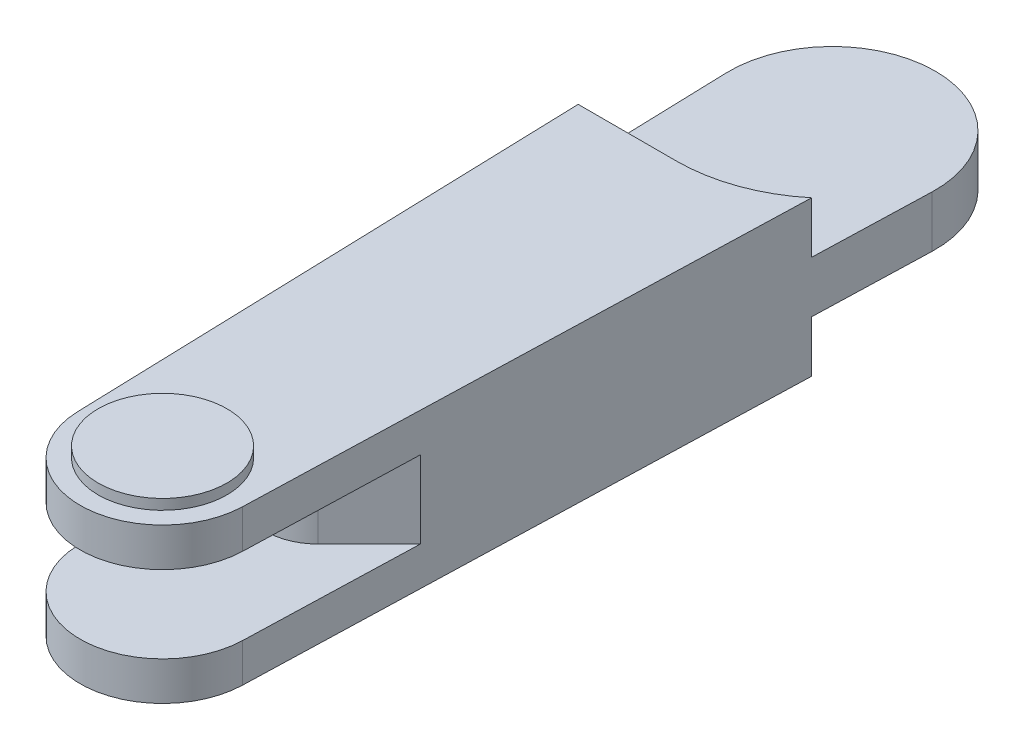
from build123d import *

# Parameters (mm, degrees)
BOSS_EXTRUDE1_DEPTH      = 1.5
BOSS_EXTRUDE1_DEPTH_BACK = 1.5
SKETCH1_R                = 1.6
SKETCH1_R_2              = 2
SKETCH2_R                = 3.025
CUT_EXTRUDE1_DEPTH       = 1
CUT_EXTRUDE2_START       = -1
SKETCH3_R                = 3.025
CUT_EXTRUDE2_DEPTH       = 1
CUT_EXTRUDE3_DEPTH       = 0.75
CUT_EXTRUDE3_DEPTH_BACK  = 0.75
SKETCH4_R                = 1.6
FILLET1_R                = 1
SKETCH5_R                = 1.25
BOSS_EXTRUDE2_DEPTH      = 0.2
BOSS_EXTRUDE3_START      = 0.2
SKETCH6_R                = 1.25
BOSS_EXTRUDE3_DEPTH      = 0.2
CUT_EXTRUDE4_DEPTH       = 1
CUT_EXTRUDE5_START       = -1
CUT_EXTRUDE5_DEPTH       = 1


with BuildPart() as part:
    # Sketch1 → Boss-Extrude1 (new, two sides: drawn at the far end of the back side and taken through both)
    with BuildSketch(Plane(origin=(0, 0, 0), x_dir=(1, 0, 0), z_dir=(0, 1, 0)).offset(-BOSS_EXTRUDE1_DEPTH_BACK)):
        with Locations((0, -6.5)):
            Circle(SKETCH1_R)
        with BuildLine():
            Line((-1.99905303, 6.438461538), (-1.599242424, -6.549230769))
            ThreePointArc((-1.599242424, -6.549230769), (-0.024618299, -4.900189405), (1.6, -6.5))
            ThreePointArc((1.6, -6.5), (1.599810595, -6.524618299), (1.599242424, -6.549230769))
            Line((1.599242424, -6.549230769), (1.99905303, 6.438461538))
            ThreePointArc((1.99905303, 6.438461538), (0, 4.5), (-1.99905303, 6.438461538))
        make_face()
        with Locations((0, 6.5)):
            Circle(SKETCH1_R_2)
    extrude(amount=BOSS_EXTRUDE1_DEPTH + BOSS_EXTRUDE1_DEPTH_BACK)

    # Sketch2 → Cut-Extrude1 (cut)
    with BuildSketch(Plane(origin=(0, 1.5, 0), x_dir=(1, 0, 0), z_dir=(0, 1, 0))):
        with Locations((0, 6.5)):
            Circle(SKETCH2_R)
    extrude(amount=-CUT_EXTRUDE1_DEPTH, mode=Mode.SUBTRACT)

    # Sketch3 → Cut-Extrude2 (cut)
    with BuildSketch(Plane.XZ.offset(1.5).offset(CUT_EXTRUDE2_START)):
        with Locations((0, -6.5)):
            Circle(SKETCH3_R)
    extrude(amount=CUT_EXTRUDE2_DEPTH, mode=Mode.SUBTRACT)

    # Sketch4 → Cut-Extrude3 (cut, two sides: drawn at the far end of the back side and taken through both)
    with BuildSketch(Plane(origin=(0, 0, 0), x_dir=(1, 0, 0), z_dir=(0, 1, 0)).offset(-CUT_EXTRUDE3_DEPTH_BACK)):
        with BuildLine():
            ThreePointArc((-1.6, -6.5), (-1.13137085, -5.36862915), (0, -4.9))
            Line((0, -4.9), (-163.946907064, 159.046907064))
            Line((-163.946907064, 159.046907064), (-163.946907064, -6.5))
            Line((-163.946907064, -6.5), (-1.6, -6.5))
        make_face()
        with BuildLine():
            Line((161.955462973, 157.055462973), (0, -4.9))
            ThreePointArc((0, -4.9), (1.13137085, -5.36862915), (1.6, -6.5))
            Line((1.6, -6.5), (161.955462973, -6.5))
            Line((161.955462973, -6.5), (161.955462973, 157.055462973))
        make_face()
        with BuildLine():
            Line((1.6, -6.5), (0, -6.5))
            Line((0, -6.5), (-1.6, -6.5))
            ThreePointArc((-1.6, -6.5), (0, -8.1), (1.6, -6.5))
        make_face()
        with BuildLine():
            Line((0, -4.9), (0, -6.5))
            Line((0, -6.5), (1.6, -6.5))
            ThreePointArc((1.6, -6.5), (1.13137085, -5.36862915), (0, -4.9))
        make_face()
        with BuildLine():
            Line((-1.6, -6.5), (0, -6.5))
            Line((0, -6.5), (0, -4.9))
            ThreePointArc((0, -4.9), (-1.13137085, -5.36862915), (-1.6, -6.5))
        make_face()
        with Locations((0, -6.5)):
            Circle(SKETCH4_R)
        Polygon((0, -6.5), (-163.946907064, -6.5), (0, -276.849985612), (161.955462973, -6.5), align=None)
    extrude(amount=CUT_EXTRUDE3_DEPTH + CUT_EXTRUDE3_DEPTH_BACK, mode=Mode.SUBTRACT)

    # Fillet1
    fillet1_edges = [part.edges().sort_by_distance(p)[0] for p in [
        (0, 0, 4.9),
    ]]
    fillet(fillet1_edges, radius=FILLET1_R)

    # Sketch5 → Boss-Extrude2 (add)
    with BuildSketch(Plane(origin=(0, 1.5, 0), x_dir=(1, 0, 0), z_dir=(0, 1, 0))):
        with Locations(Location((0, -6.5, 0), (0, 0, 270))):
            Circle(SKETCH5_R)
    extrude(amount=BOSS_EXTRUDE2_DEPTH)

    # Sketch6 → Boss-Extrude3 (add)
    with BuildSketch(Plane.XZ.offset(1.5).offset(BOSS_EXTRUDE3_START)):
        with Locations(Location((0, 6.5, 0), (0, 0, 90))):
            Circle(SKETCH6_R)
    extrude(amount=-BOSS_EXTRUDE3_DEPTH)

    # Sketch7 → Cut-Extrude4 (cut)
    with BuildSketch(Plane(origin=(0, 1.5, 0), x_dir=(1, 0, 0), z_dir=(0, 1, 0))):
        with BuildLine():
            Line((-1.907826404, 3.475), (0, 3.475))
            ThreePointArc((0, 3.475), (-1.025301843, 3.654058832), (-1.929222297, 4.170037268))
            Line((-1.929222297, 4.170037268), (-1.907826404, 3.475))
        make_face()
    extrude(amount=-CUT_EXTRUDE4_DEPTH, mode=Mode.SUBTRACT)

    # Sketch8 → Cut-Extrude5 (cut)
    with BuildSketch(Plane.XZ.offset(1.5).offset(CUT_EXTRUDE5_START)):
        with BuildLine():
            ThreePointArc((-1.929222297, -4.170037268), (-1.025301843, -3.654058832), (0, -3.475))
            Line((0, -3.475), (-1.907826404, -3.475))
            Line((-1.907826404, -3.475), (-1.929222297, -4.170037268))
        make_face()
    extrude(amount=CUT_EXTRUDE5_DEPTH, mode=Mode.SUBTRACT)


solid = part.part
